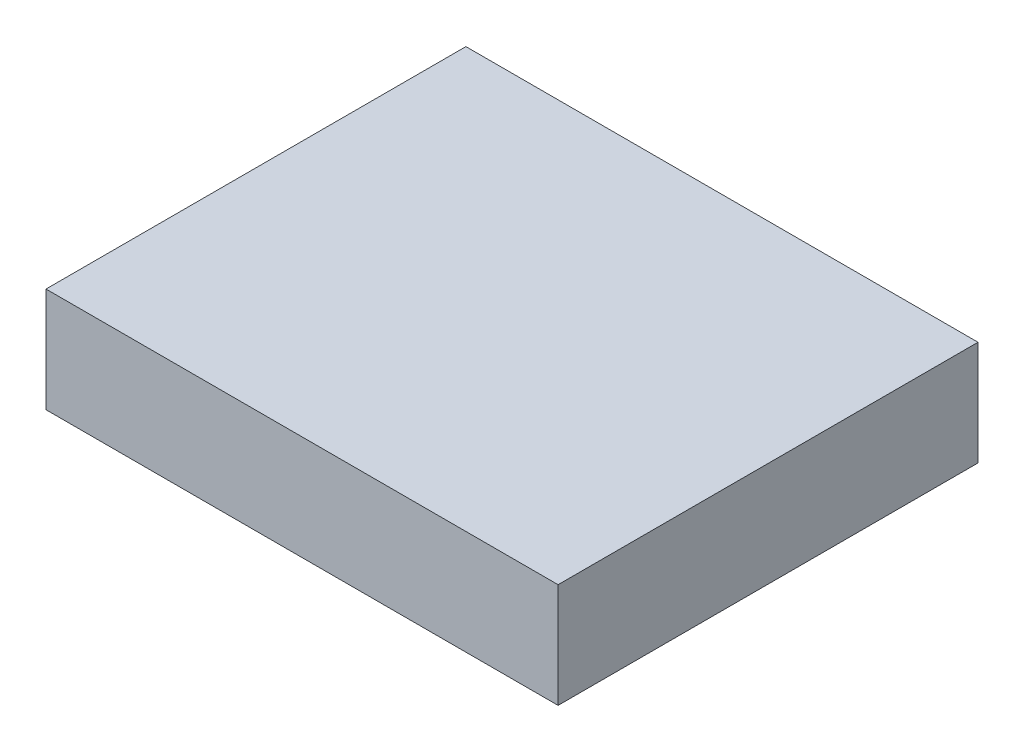
from build123d import *

# Parameters (mm, degrees)
SKETCH1_W           = 12
SKETCH1_H           = 9.84
BOSS_EXTRUDE1_DEPTH = 2.45


with BuildPart() as part:
    # Sketch1 → Boss-Extrude1 (new body)
    with BuildSketch(Plane(origin=(0, 0, 0), x_dir=(1, 0, 0), z_dir=(0, 1, 0))):
        with Locations((6, 4.92)):
            Rectangle(SKETCH1_W, SKETCH1_H)
    extrude(amount=BOSS_EXTRUDE1_DEPTH)


solid = part.part
